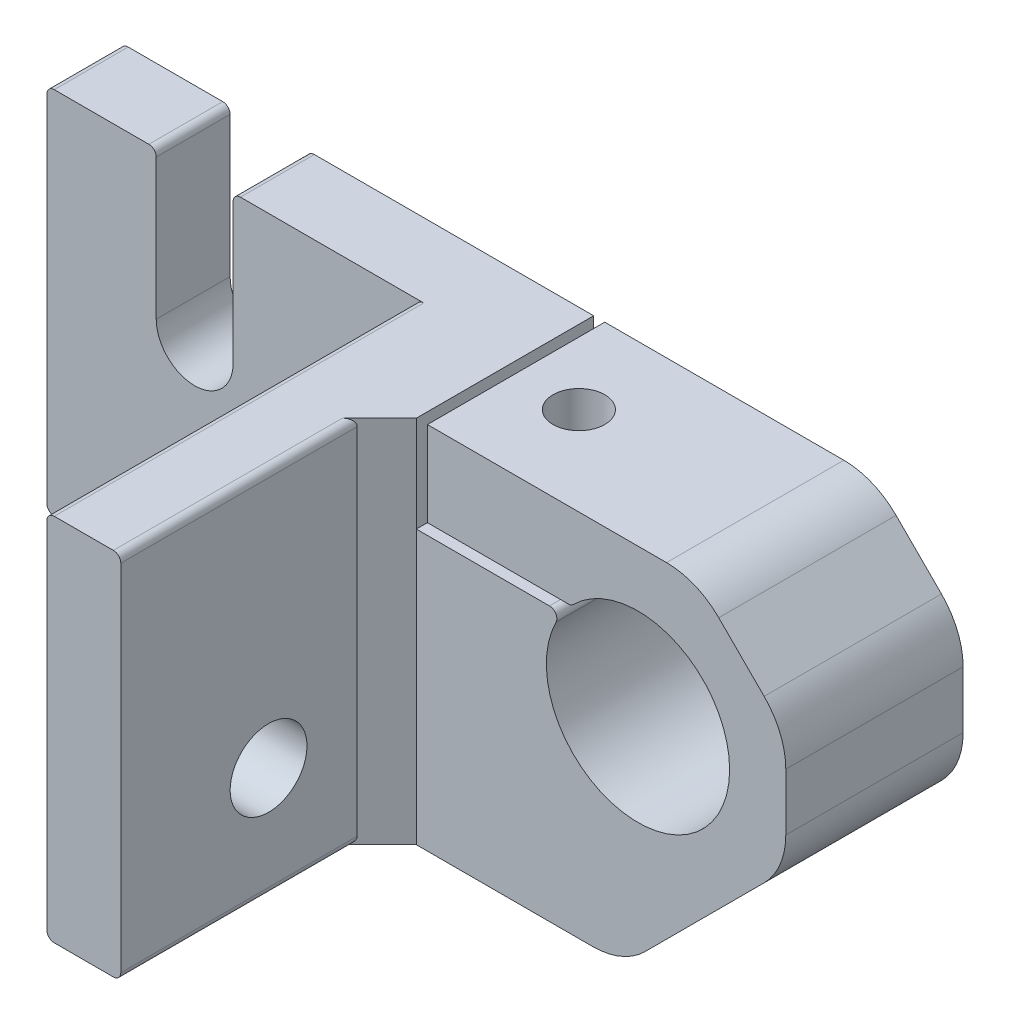
from build123d import *

# Parameters (mm, degrees)
BOSS_EXTRUDE1_DEPTH = 12
SKETCH3_W           = 25
SKETCH3_H           = 25
CUT_EXTRUDE1_DEPTH  = 7
SKETCH4_W           = 18
SKETCH4_H           = 25
SKETCH4_R           = 2.6
BOSS_EXTRUDE2_DEPTH = 5
CHAMFER1_SIZE       = 2
CUT_EXTRUDE2_DEPTH  = 5
FILLET1_R           = 5
FILLET2_R           = 0.5


with BuildPart() as part:
    # Sketch1 → Boss-Extrude1 (new body)
    with BuildSketch(Plane.XY):
        with BuildLine():
            Line((-22.5, 12.5), (-28.5, 6.5))
            Line((-28.5, 6.5), (-28.5, -1.5))
            Line((-28.5, -1.5), (-17.5, -12.5))
            Line((-17.5, -12.5), (28.5, -12.5))
            Line((28.5, -12.5), (28.5, 12.5))
            Line((28.5, 12.5), (-3.5, 12.5))
            Line((-3.5, 12.5), (-3.5, 6))
            Line((-3.5, 6), (-13.382383367, 6))
            ThreePointArc((-13.382383367, 6), (-23.330458604, -1.386729946), (-13.985855563, 6.75))
            Line((-13.985855563, 6.75), (-4.25, 6.75))
            Line((-4.25, 6.75), (-4.25, 12.5))
            Line((-4.25, 12.5), (-5.7, 12.5))
            Line((-5.7, 12.5), (-22.5, 12.5))
        make_face()
    extrude(amount=BOSS_EXTRUDE1_DEPTH)

    # Sketch3 → Cut-Extrude1 (cut)
    with BuildSketch(Plane.XY.offset(12)):
        with Locations((16, 0)):
            Rectangle(SKETCH3_W, SKETCH3_H)
    extrude(amount=-CUT_EXTRUDE1_DEPTH, mode=Mode.SUBTRACT)

    # Sketch4 → Boss-Extrude2 (add)
    with BuildSketch(Plane(origin=(3.5, 0, 0), x_dir=(0, 0, -1), z_dir=(1, 0, 0))):
        with Locations((-21, 0)):
            Rectangle(SKETCH4_W, SKETCH4_H)
        with Locations(Location((-20, -5, 0), (0, 0, 90))):
            Circle(SKETCH4_R, mode=Mode.SUBTRACT)
    extrude(amount=-BOSS_EXTRUDE2_DEPTH)

    # Chamfer1
    chamfer1_edges = [part.edges().sort_by_distance(p)[0] for p in [
        (-1.5, 0, 12),
    ]]
    chamfer(chamfer1_edges, length=CHAMFER1_SIZE)

    # Sketch5 → Cut-Extrude2 (cut)
    with BuildSketch(Plane.XY.offset(5)):
        with BuildLine():
            Line((15.9, 2.5), (15.9, 12.5))
            Line((15.9, 12.5), (21.1, 12.5))
            Line((21.1, 12.5), (21.1, 2.5))
            ThreePointArc((21.1, 2.5), (18.5, -0.1), (15.9, 2.5))
        make_face()
    extrude(amount=-CUT_EXTRUDE2_DEPTH, mode=Mode.SUBTRACT)

    # Fillet1
    fillet1_edges = [part.edges().sort_by_distance(p)[0] for p in [
        (-17.5, -12.5, 6),
        (-28.5, -1.5, 6),
        (-28.5, 6.5, 6),
        (-22.5, 12.5, 6),
    ]]
    fillet(fillet1_edges, radius=FILLET1_R)

    # Fillet2
    fillet2_edges = [part.edges().sort_by_distance(p)[0] for p in [
        (-13.985855563, 6.75, 6),
        (-13.382383367, 6, 6),
        (28.5, 12.5, 2.5),
        (28.5, -12.5, 2.5),
        (3.5, -12.5, 17.5),
        (3.5, 12.5, 17.5),
        (-1.5, -12.5, 22),
        (-1.5, 12.5, 22),
        (15.9, 12.5, 2.5),
        (21.1, 12.5, 2.5),
    ]]
    fillet(fillet2_edges, radius=FILLET2_R)

    # Sketch6 → Cut-Revolve1 (revolve, cut)
    with BuildSketch(Plane(origin=(0, 0, 6), x_dir=(-1, 0, 0), z_dir=(0, 0, -1)), mode=Mode.PRIVATE) as cut_revolve1_sk:
        Polygon((8.5, 12.5), (10.25, 12.5), (10.25, -7.5), (10.85, -7.5), (10.85, -12), (11, -12), (11, -12.5), (8.5, -12.5), align=None)
    revolve(cut_revolve1_sk.sketch.rotate(Axis((-8.5, 12.5, 6), (0, -1, 0)), 270), axis=Axis((-8.5, 12.5, 6), (0, -1, 0)), mode=Mode.SUBTRACT)


with BuildPart() as body_2:
    # Mirror1: mirrored copy
    add(part.part.mirror(Plane(origin=(0, 0, 0), x_dir=(0, 0, 1), z_dir=(1, 0, 0))))


solid = body_2.part
